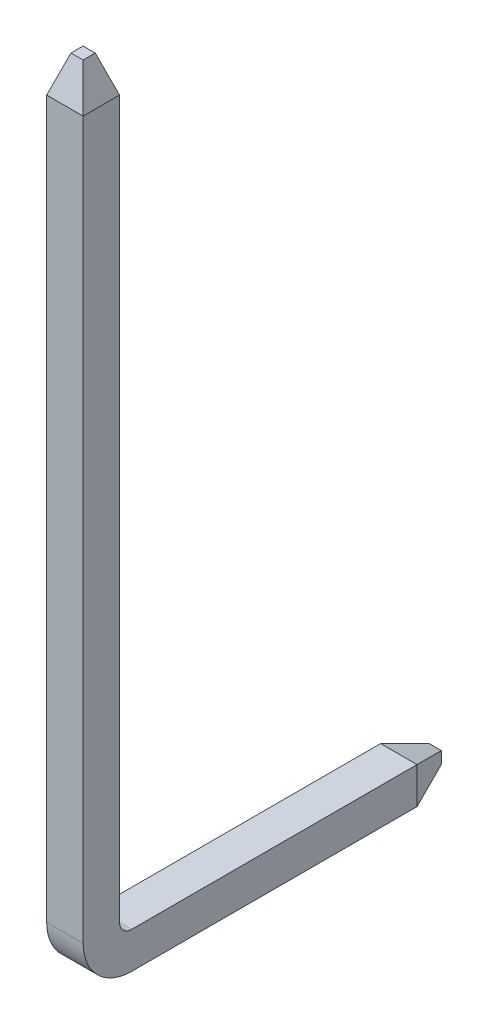
from build123d import *
from OCP.BRepFilletAPI import BRepFilletAPI_MakeChamfer

# Parameters (mm, degrees)
AUFSATZ_LINEAR_AUSTRAGEN1_DEPTH = 0.6
FASE1_SIZE                      = 0.2
FASE1_SIZE2                     = 0.6


with BuildPart() as part:
    # Skizze1 → Aufsatz-Linear austragen1 (new body)
    with BuildSketch(Plane(origin=(0, 0, 0), x_dir=(0, 0, -1), z_dir=(1, 0, 0))):
        with BuildLine():
            Line((0, 0.2), (0, 12.6))
            Line((0, 12.6), (-0.6, 12.6))
            Line((-0.6, 12.6), (-0.6, 0.2))
            ThreePointArc((-0.6, 0.2), (-0.365685425, -0.365685425), (0.2, -0.6))
            Line((0.2, -0.6), (5.5, -0.6))
            Line((5.5, -0.6), (5.5, 0))
            Line((5.5, 0), (0.2, 0))
            ThreePointArc((0.2, 0), (0.058578644, 0.058578644), (0, 0.2))
        make_face()
    extrude(amount=AUFSATZ_LINEAR_AUSTRAGEN1_DEPTH)

    # Fase1: one chamfer whose edges measure the first distance from different faces: ONE call of the kernel's chamfer builder (chamfer() names one face for all edges)
    fase1_edges_1 = [part.edges().sort_by_distance(p)[0] for p in [
        (0, 12.6, 0.3),
        (0.3, 12.6, 0),
        (0.3, 12.6, 0.6),
        (0.6, 12.6, 0.3),
    ]]
    fase1_side_1 = [part.faces().sort_by_distance(p)[0] for p in [
        (0.3, 12.6, 0.3),
    ]]
    fase1_edges_2 = [part.edges().sort_by_distance(p)[0] for p in [
        (0.3, 0, -5.5),
        (0.3, -0.6, -5.5),
        (0.6, -0.3, -5.5),
        (0, -0.3, -5.5),
    ]]
    fase1_side_2 = [part.faces().sort_by_distance(p)[0] for p in [
        (0.3, -0.3, -5.5),
    ]]
    fase1 = BRepFilletAPI_MakeChamfer(part.part.solid().wrapped)
    for e in fase1_edges_1:
        fase1.Add(FASE1_SIZE, FASE1_SIZE2, e.wrapped, fase1_side_1[0].wrapped)  # the first distance lies on this face
    for e in fase1_edges_2:
        fase1.Add(FASE1_SIZE, FASE1_SIZE2, e.wrapped, fase1_side_2[0].wrapped)  # the first distance lies on this face
    add(Compound.cast(fase1.Shape()), mode=Mode.REPLACE)


solid = part.part
